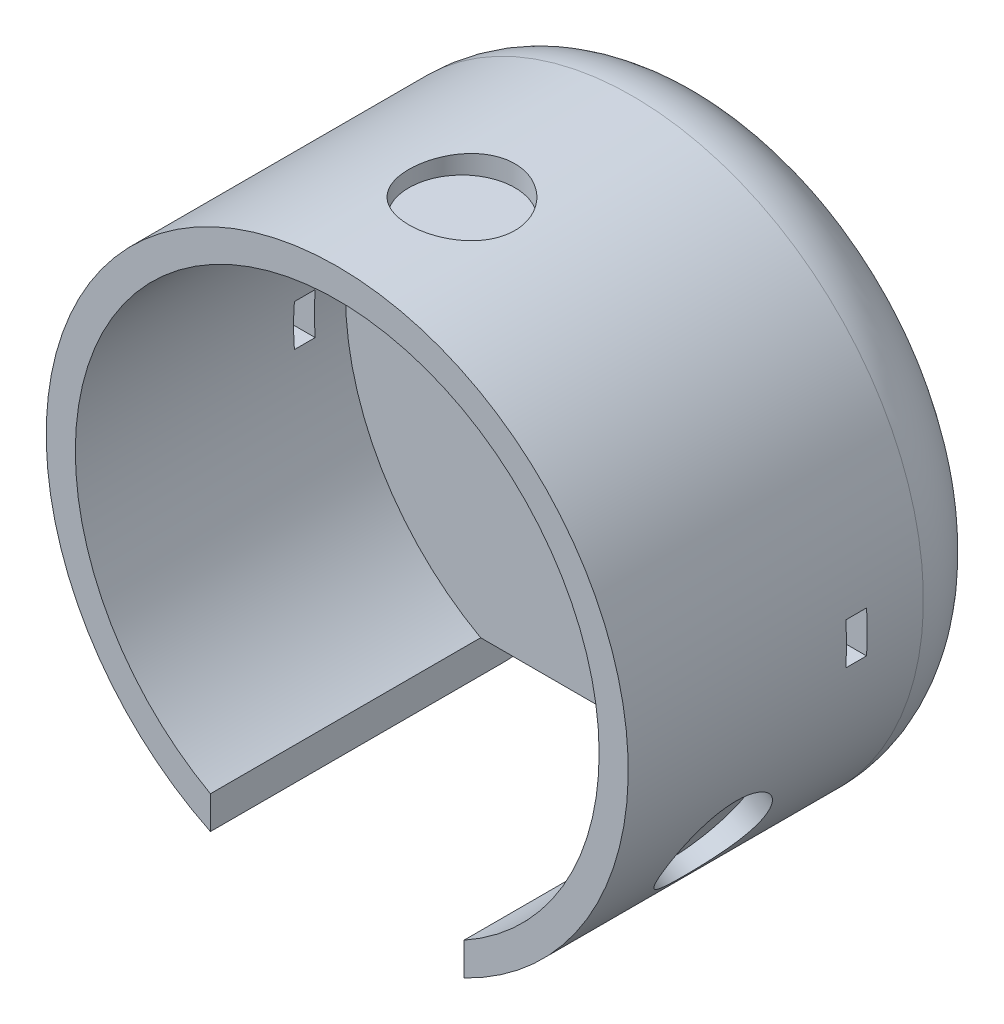
from build123d import *
from build123d.topology import SkipClean

# Parameters (mm, degrees)
SKETCH1_R           = 17.78
SKETCH1_R_2         = 16.002
BOSS_EXTRUDE1_DEPTH = 16.51
BOSS_EXTRUDE2_START = 6.604
SKETCH2_R           = 17.78
BOSS_EXTRUDE2_DEPTH = 6.604
FILLET1_R           = 5.08
SKETCH3_R           = 3.2385
CUT_EXTRUDE1_DEPTH  = 1.27
CIRPATTERN1_COUNT   = 3
CUT_EXTRUDE4_DEPTH  = 35.154264787
SKETCH7_W           = 1.27
SKETCH7_H           = 2.54
CUT_EXTRUDE5_DEPTH  = 44.049066354


with BuildPart() as part:
    # Sketch1 → Boss-Extrude1 (new body)
    with BuildSketch(Plane.XY):
        Circle(SKETCH1_R)
        Circle(SKETCH1_R_2, mode=Mode.SUBTRACT)
    extrude(amount=BOSS_EXTRUDE1_DEPTH)

    # Sketch2 → Boss-Extrude2 (add)
    with BuildSketch(Plane(origin=(0, 0, 0), x_dir=(-1, 0, 0), z_dir=(0, 0, -1)).offset(BOSS_EXTRUDE2_START)):
        Circle(SKETCH2_R)
    extrude(amount=-BOSS_EXTRUDE2_DEPTH)

    # Fillet1
    fillet1_edges = [part.edges().sort_by_distance(p)[0] for p in [
        (17.78, 0, -6.604),
    ]]
    fillet(fillet1_edges, radius=FILLET1_R)

    # Sketch3 → Cut-Extrude1 (cut)
    with BuildSketch(Plane(origin=(0, 17.78, 0), x_dir=(1, 0, 0), z_dir=(0, 1, 0))):
        with Locations(Location((0, -8.89, 0), (0, 0, 270))):
            Circle(SKETCH3_R)
    cut_extrude1 = extrude(amount=-CUT_EXTRUDE1_DEPTH, mode=Mode.SUBTRACT)

    # CirPattern1: Cut-Extrude1 ×3 about axis
    cirpattern1_axis = Axis((0, 0, 0), (0, 0, 1))
    for i in range(1, CIRPATTERN1_COUNT):
        add(cut_extrude1.rotate(cirpattern1_axis, i * 360 / CIRPATTERN1_COUNT), mode=Mode.SUBTRACT)

    # Sketch6 → Cut-Extrude4 (cut, through all)
    with SkipClean():  # the faces are left unmerged after this step: merging them gives an invalid solid
        with BuildSketch(Plane.XY.offset(16.51)):
            with BuildLine():
                Line((-7.747, -16.003511833), (-7.747, -14.001714002))
                Line((-7.747, -14.001714002), (7.747, -14.001714002))
                Line((7.747, -14.001714002), (7.747, -16.003511833))
                ThreePointArc((7.747, -16.003511833), (0, -17.78), (-7.747, -16.003511833))
            make_face()
        extrude(amount=-CUT_EXTRUDE4_DEPTH, mode=Mode.SUBTRACT)

    # Sketch7 → Cut-Extrude5 (cut, through all)
    with SkipClean():  # the faces are left unmerged after this step: merging them gives an invalid solid
        with BuildSketch(Plane(origin=(17.78, 0, 0), x_dir=(0, 0, -1), z_dir=(1, 0, 0))):
            with Locations((-2.54, 0)):
                Rectangle(SKETCH7_W, SKETCH7_H)
        extrude(amount=-CUT_EXTRUDE5_DEPTH, mode=Mode.SUBTRACT)


solid = part.part
